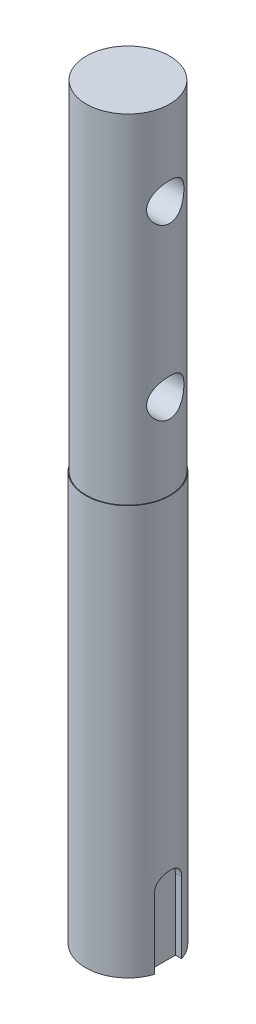
from build123d import *

# Parameters (mm, degrees)
SKETCH1_R               = 25
BOSS_EXTRUDE1_DEPTH     = 241.5
SKETCH2_R               = 24.61
BOSS_EXTRUDE2_DEPTH     = 200
CUT_EXTRUDE1_DEPTH      = 5
CUT_EXTRUDE2_DEPTH      = 443.913366258
CUT_EXTRUDE2_DEPTH_BACK = 443.913366258
SKETCH4_R               = 11


with BuildPart() as part:
    # Sketch1 → Boss-Extrude1 (new body)
    with BuildSketch(Plane(origin=(0, 0, 0), x_dir=(1, 0, 0), z_dir=(0, 1, 0))):
        with Locations(Location((0, 0, 0), (0, 0, 270))):
            Circle(SKETCH1_R)
    extrude(amount=BOSS_EXTRUDE1_DEPTH)

    # Sketch2 → Boss-Extrude2 (add)
    with BuildSketch(Plane(origin=(0, 241.5, 0), x_dir=(1, 0, 0), z_dir=(0, 1, 0))):
        with Locations(Location((0, 0, 0), (0, 0, 270))):
            Circle(SKETCH2_R)
    extrude(amount=BOSS_EXTRUDE2_DEPTH)

    # Sketch3 → Cut-Extrude1 (cut)
    with BuildSketch(Plane(origin=(25, 0, 0), x_dir=(0, 0, -1), z_dir=(1, 0, 0))):
        with BuildLine():
            Line((-8, 42), (-8, 0))
            Line((-8, 0), (8, 0))
            Line((8, 0), (8, 42))
            ThreePointArc((8, 42), (0, 50), (-8, 42))
        make_face()
    extrude(amount=-CUT_EXTRUDE1_DEPTH, mode=Mode.SUBTRACT)

    # Sketch4 → Cut-Extrude2 (cut, two sides: drawn at the far end of the back side and taken through both)
    with BuildSketch(Plane(origin=(0, 0, 0), x_dir=(0, 0, -1), z_dir=(1, 0, 0)).offset(-CUT_EXTRUDE2_DEPTH_BACK)):
        with Locations((0, 291.5)):
            Circle(SKETCH4_R)
        with Locations((0, 391.5)):
            Circle(SKETCH4_R)
    extrude(amount=CUT_EXTRUDE2_DEPTH + CUT_EXTRUDE2_DEPTH_BACK, mode=Mode.SUBTRACT)


solid = part.part
